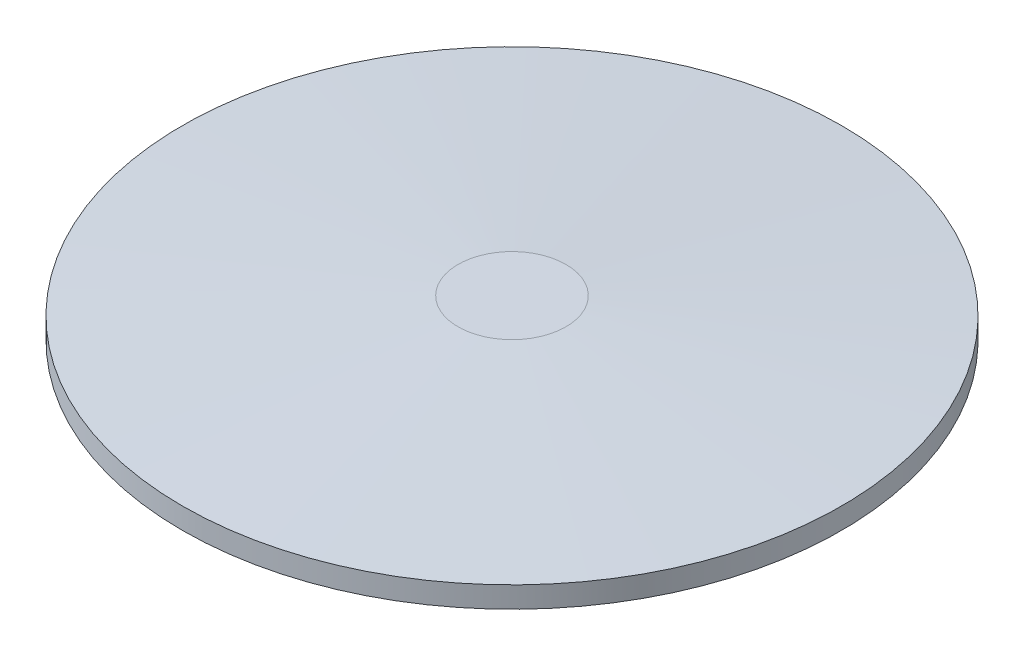
from build123d import *


with BuildPart() as part:
    # Sketch9 → Revolve1 (revolve)
    with BuildSketch(Plane.XY, mode=Mode.PRIVATE) as revolve1_sk:
        Polygon((0, -3.369253692), (6.175767626, -3.369253692), (6.175767626, -2.583519101), (37.7, -1.21594951), (37.7, 1.203589148), (6.175767626, 3.202344705), (0, 3.202344705), align=None)
    revolve(revolve1_sk.sketch.rotate(Axis((0, -3.369253692, 0), (0, 1, 0)), 90), axis=Axis((0, -3.369253692, 0), (0, 1, 0)))


solid = part.part
